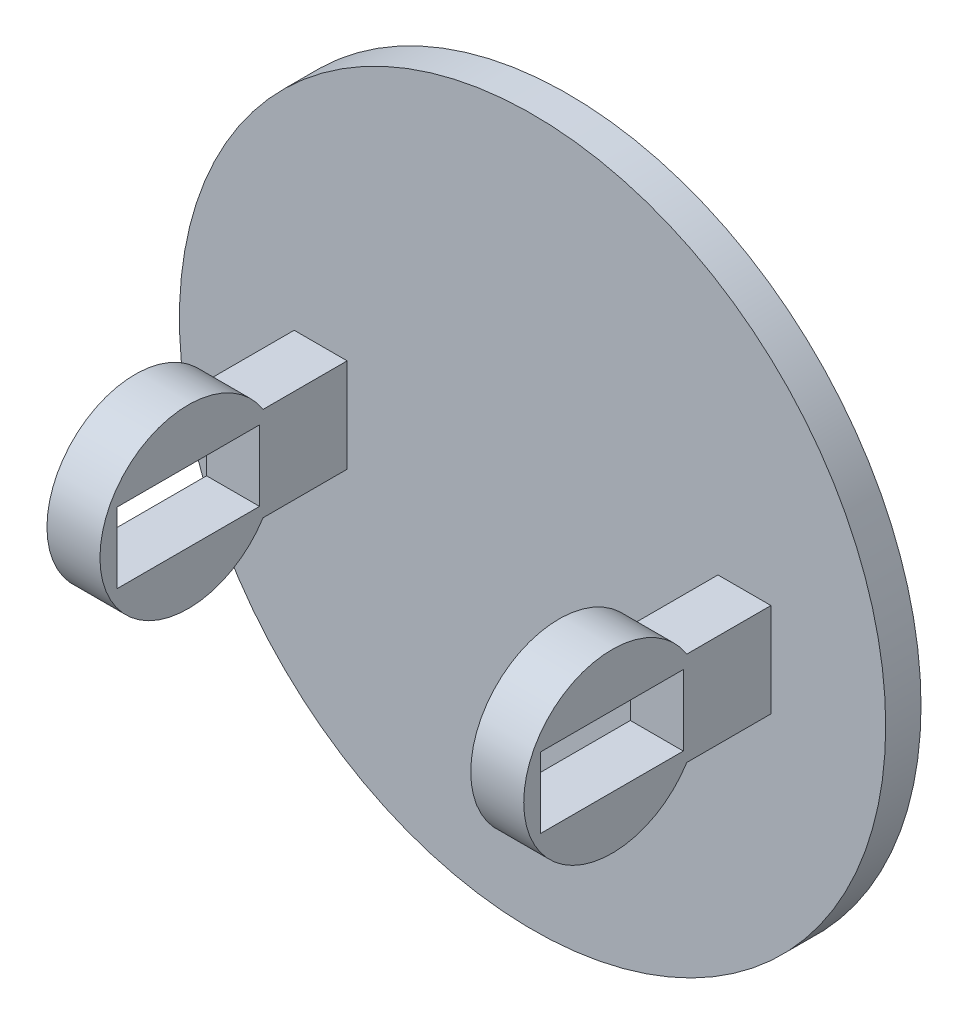
from build123d import *

# Parameters (mm, degrees)
SKETCH1_R           = 100
BOSS_EXTRUDE1_DEPTH = 10
SKETCH2_R           = 25
BOSS_EXTRUDE2_DEPTH = 25
SKETCH3_W           = 15
SKETCH3_H           = 80
BOSS_EXTRUDE3_DEPTH = 70
CUT_EXTRUDE1_DEPTH  = 40
SKETCH7_W           = 40.381813508
SKETCH7_H           = 20
CUT_EXTRUDE2_DEPTH  = 208.25889607


with BuildPart() as part:
    # Sketch1 → Boss-Extrude1 (new body)
    with BuildSketch(Plane.XY):
        Circle(SKETCH1_R)
    extrude(amount=-BOSS_EXTRUDE1_DEPTH)

    # Sketch2 → Boss-Extrude2 (add)
    with BuildSketch(Plane(origin=(0, 0, -10), x_dir=(-1, 0, 0), z_dir=(0, 0, -1))):
        Circle(SKETCH2_R)
    extrude(amount=BOSS_EXTRUDE2_DEPTH)

    # Sketch3 → Boss-Extrude3 (add)
    with BuildSketch(Plane.XY):
        with Locations((-60, 0)):
            Rectangle(SKETCH3_W, SKETCH3_H)
    boss_extrude3 = extrude(amount=BOSS_EXTRUDE3_DEPTH)

    # Sketch5 → Cut-Extrude1 (cut)
    with BuildSketch(Plane.ZY.offset(67.5)):
        with BuildLine():
            Line((70, 0), (70, 40))
            Line((70, 40), (0, 40))
            Line((0, 40), (0, 13.288234805))
            Line((0, 13.288234805), (23.824003784, 13.288234805))
            ThreePointArc((23.824003784, 13.288234805), (51.913757827, 24.024986008), (70, 0))
        make_face()
        with BuildLine():
            Line((70, -40), (70, 0))
            ThreePointArc((70, 0), (51.913757827, -24.024986008), (23.824003784, -13.288234805))
            Line((23.824003784, -13.288234805), (0, -13.288234805))
            Line((0, -13.288234805), (0, -40))
            Line((0, -40), (70, -40))
        make_face()
    cut_extrude1 = extrude(amount=-CUT_EXTRUDE1_DEPTH, mode=Mode.SUBTRACT)

    # Mirror2: Boss-Extrude3, Cut-Extrude1 across plane
    add(boss_extrude3.mirror(Plane(origin=(0, 0, 0), x_dir=(0, 0, 1), z_dir=(1, 0, 0))))
    add(cut_extrude1.mirror(Plane(origin=(0, 0, 0), x_dir=(0, 0, 1), z_dir=(1, 0, 0))), mode=Mode.SUBTRACT)

    # Sketch7 → Cut-Extrude2 (cut, through all)
    with BuildSketch(Plane.ZY.offset(67.5)):
        with Locations((45, 0)):
            Rectangle(SKETCH7_W, SKETCH7_H)
    extrude(amount=-CUT_EXTRUDE2_DEPTH, mode=Mode.SUBTRACT)


solid = part.part
